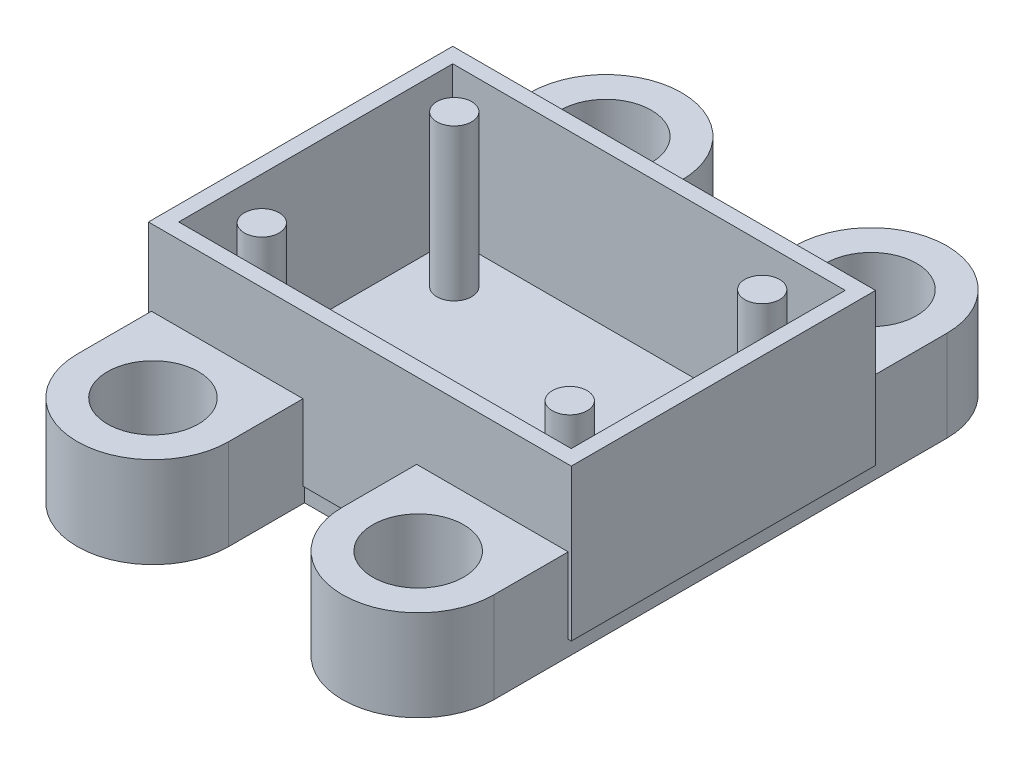
from build123d import *

# Parameters (mm, degrees)
SKETCH1_W           = 27.9
SKETCH1_H           = 20.08
SKETCH1_W_2         = 25.9
SKETCH1_H_2         = 18.08
BOSS_EXTRUDE1_DEPTH = 10
SKETCH3_W           = 27.5
SKETCH3_H           = 19.88
BOSS_EXTRUDE2_DEPTH = 1
SKETCH4_R           = 1.15
BOSS_EXTRUDE3_DEPTH = 10
SKETCH12_R          = 3
BOSS_EXTRUDE6_DEPTH = 6


with BuildPart() as part:
    # Sketch1 → Boss-Extrude1 (new body)
    with BuildSketch(Plane(origin=(0, 0, 0), x_dir=(1, 0, 0), z_dir=(0, 1, 0))):
        Rectangle(SKETCH1_W, SKETCH1_H)
        Rectangle(SKETCH1_W_2, SKETCH1_H_2, mode=Mode.SUBTRACT)
    extrude(amount=BOSS_EXTRUDE1_DEPTH)

    # Sketch3 → Boss-Extrude2 (add)
    with BuildSketch(Plane(origin=(0, 0, 0), x_dir=(1, 0, 0), z_dir=(0, 1, 0))):
        Rectangle(SKETCH3_W, SKETCH3_H)
    extrude(amount=-BOSS_EXTRUDE2_DEPTH)

    # Sketch4 → Boss-Extrude3 (add)
    with BuildSketch(Plane(origin=(0, 0, 0), x_dir=(1, 0, 0), z_dir=(0, 1, 0))):
        with Locations((-10.16, 6.35)):
            Circle(SKETCH4_R)
        with Locations((10.16, 6.35)):
            Circle(SKETCH4_R)
        with Locations((-10.16, -6.35)):
            Circle(SKETCH4_R)
        with Locations((10.16, -6.35)):
            Circle(SKETCH4_R)
    extrude(amount=BOSS_EXTRUDE3_DEPTH)

    # Sketch12 → Boss-Extrude6 (add)
    # profile 1 of 4: a face of its own
    with BuildSketch(Plane(origin=(40.87798925, -1, 20.164210109), x_dir=(-1, 0, 0), z_dir=(0, -1, 0))):
        with BuildLine():
            Line((27.12798925, 35.104210109), (27.12798925, 30.104210109))
            Line((27.12798925, 30.104210109), (37.12798925, 30.104210109))
            Line((37.12798925, 30.104210109), (37.12798925, 35.104210109))
            ThreePointArc((37.12798925, 35.104210109), (32.12798925, 40.104210109), (27.12798925, 35.104210109))
        make_face()
        with Locations((32.12798925, 35.104210109)):
            Circle(SKETCH12_R, mode=Mode.SUBTRACT)
    # profile 2 of 4: a face of its own
    with BuildSketch(Plane(origin=(40.87798925, -1, 20.164210109), x_dir=(-1, 0, 0), z_dir=(0, -1, 0))):
        with BuildLine():
            Line((37.12798925, 5.224210109), (37.12798925, 10.224210109))
            Line((37.12798925, 10.224210109), (27.12798925, 10.224210109))
            Line((27.12798925, 10.224210109), (27.12798925, 5.224210109))
            ThreePointArc((27.12798925, 5.224210109), (32.12798925, 0.224210109), (37.12798925, 5.224210109))
        make_face()
        with Locations((32.12798925, 5.224210109)):
            Circle(SKETCH12_R, mode=Mode.SUBTRACT)
    # profile 3 of 4: a face of its own
    with BuildSketch(Plane(origin=(40.87798925, -1, 20.164210109), x_dir=(-1, 0, 0), z_dir=(0, -1, 0))):
        with BuildLine():
            Line((54.62798925, 5.224210109), (54.62798925, 10.224210109))
            Line((54.62798925, 10.224210109), (44.62798925, 10.224210109))
            Line((44.62798925, 10.224210109), (44.62798925, 5.224210109))
            ThreePointArc((44.62798925, 5.224210109), (49.62798925, 0.224210109), (54.62798925, 5.224210109))
        make_face()
        with Locations((49.62798925, 5.224210109)):
            Circle(SKETCH12_R, mode=Mode.SUBTRACT)
    # profile 4 of 4: a face of its own
    with BuildSketch(Plane(origin=(40.87798925, -1, 20.164210109), x_dir=(-1, 0, 0), z_dir=(0, -1, 0))):
        with BuildLine():
            Line((44.62798925, 35.104210109), (44.62798925, 30.104210109))
            Line((44.62798925, 30.104210109), (54.62798925, 30.104210109))
            Line((54.62798925, 30.104210109), (54.62798925, 35.104210109))
            ThreePointArc((54.62798925, 35.104210109), (49.62798925, 40.104210109), (44.62798925, 35.104210109))
        make_face()
        with Locations((49.62798925, 35.104210109)):
            Circle(SKETCH12_R, mode=Mode.SUBTRACT)
    extrude(amount=-BOSS_EXTRUDE6_DEPTH)


solid = part.part
